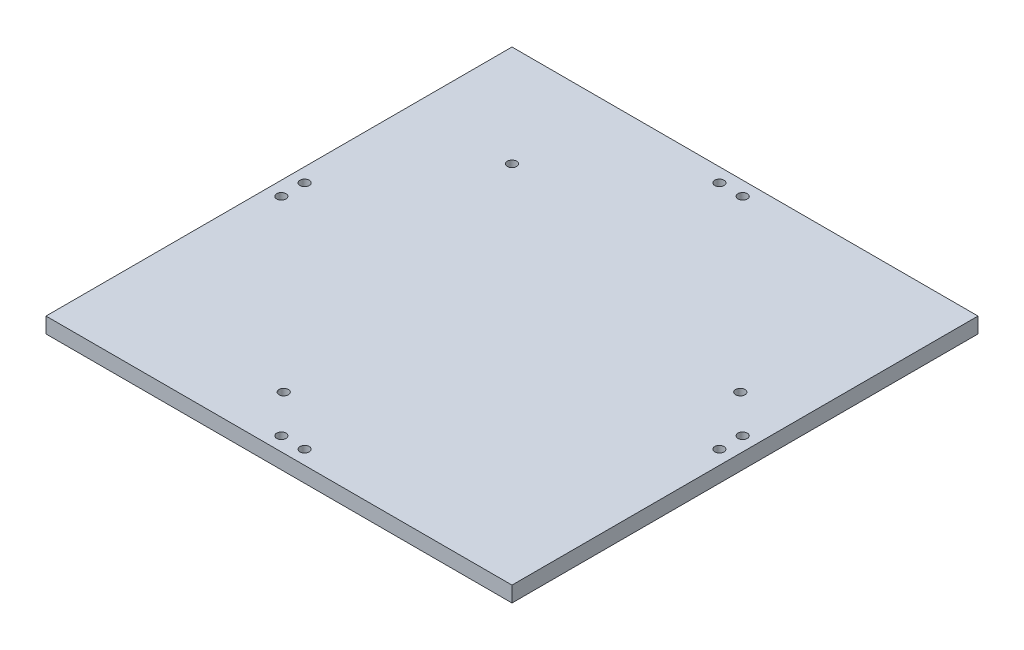
from build123d import *

# Parameters (mm, degrees)
SKETCH1_W           = 300
SKETCH1_H           = 300
SKETCH1_R           = 3
BOSS_EXTRUDE1_DEPTH = 10
SKETCH2_R           = 3
CUT_EXTRUDE1_DEPTH  = 30


with BuildPart() as part:
    # Sketch1 → Boss-Extrude1 (new body)
    with BuildSketch(Plane(origin=(0, 0, 0), x_dir=(1, 0, 0), z_dir=(0, 1, 0))):
        Rectangle(SKETCH1_W, SKETCH1_H)
        with Locations(Location((-141, 7.5, 0), (0, 0, 270))):
            Circle(SKETCH1_R, mode=Mode.SUBTRACT)
        with Locations(Location((-141, -7.5, 0), (0, 0, 270))):
            Circle(SKETCH1_R, mode=Mode.SUBTRACT)
        with Locations(Location((7.5, 141, 0), (0, 0, 270))):
            Circle(SKETCH1_R, mode=Mode.SUBTRACT)
        with Locations(Location((-7.5, 141, 0), (0, 0, 270))):
            Circle(SKETCH1_R, mode=Mode.SUBTRACT)
        with Locations(Location((141, -7.5, 0), (0, 0, 270))):
            Circle(SKETCH1_R, mode=Mode.SUBTRACT)
        with Locations(Location((141, 7.5, 0), (0, 0, 270))):
            Circle(SKETCH1_R, mode=Mode.SUBTRACT)
        with Locations(Location((-7.5, -141, 0), (0, 0, 270))):
            Circle(SKETCH1_R, mode=Mode.SUBTRACT)
        with Locations(Location((7.5, -141, 0), (0, 0, 270))):
            Circle(SKETCH1_R, mode=Mode.SUBTRACT)
    extrude(amount=BOSS_EXTRUDE1_DEPTH)

    # Sketch2 → Cut-Extrude1 (cut)
    with BuildSketch(Plane(origin=(0, 10, 0), x_dir=(1, 0, 0), z_dir=(0, 1, 0))):
        with Locations(Location((-84.852813742, 84.852813742, 0), (0, 0, 270))):
            Circle(SKETCH2_R)
        with Locations(Location((115.911099155, 31.058285412, 0), (0, 0, 270))):
            Circle(SKETCH2_R)
        with Locations(Location((-31.058285412, -115.911099155, 0), (0, 0, 270))):
            Circle(SKETCH2_R)
    extrude(amount=-CUT_EXTRUDE1_DEPTH, mode=Mode.SUBTRACT)


solid = part.part
